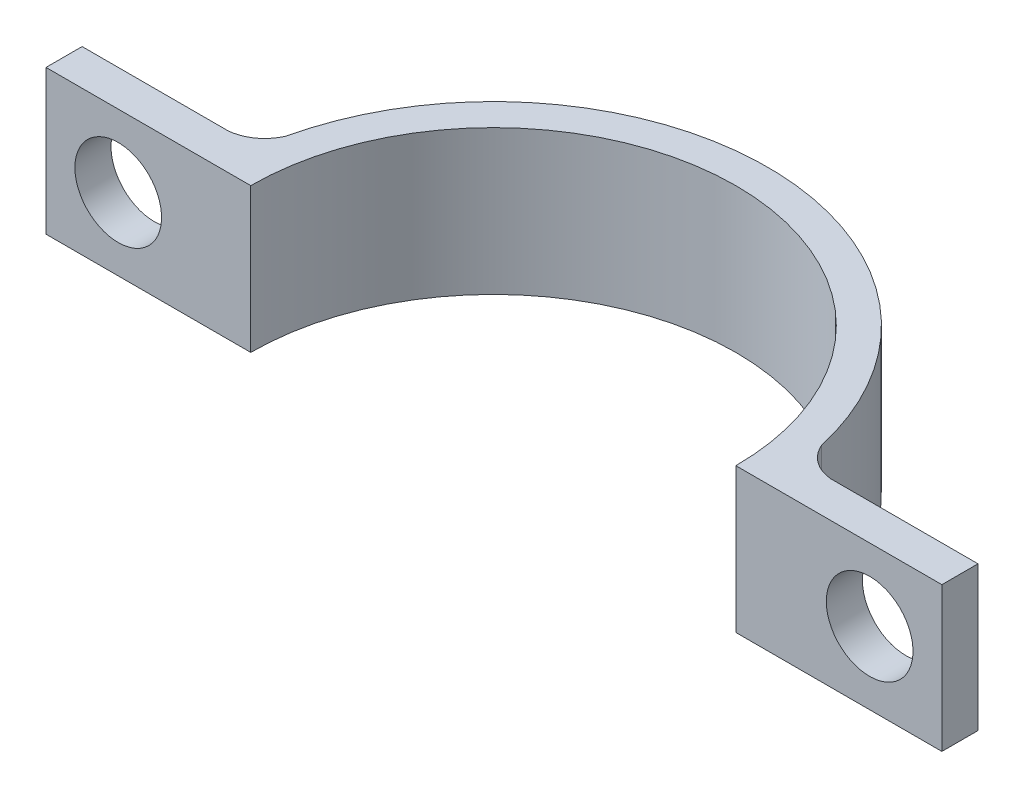
from build123d import *

# Parameters (mm, degrees)
BOSS_EXTRUDE1_DEPTH = 10
SKETCH2_R           = 3
CUT_EXTRUDE1_DEPTH  = 8


with BuildPart() as part:
    # Sketch1 → Boss-Extrude1 (new body)
    with BuildSketch(Plane(origin=(0, 0, 0), x_dir=(1, 0, 0), z_dir=(0, 1, 0))):
        with BuildLine():
            Line((-14.99271565, -10.052675371), (-29.165444207, -10.052675371))
            Line((-29.165444207, -10.052675371), (-29.165444207, -7.552675371))
            Line((-29.165444207, -7.552675371), (-19.04460375, -7.552675371))
            ThreePointArc((-19.04460375, -7.552675371), (-17.652378747, -7.021091902), (-16.731881464, -5.849103764))
            ThreePointArc((-16.731881464, -5.849103764), (1.79728435, 8.947324629), (20.326450163, -5.849103764))
            ThreePointArc((20.326450163, -5.849103764), (21.246947447, -7.021091902), (22.63917245, -7.552675371))
            Line((22.63917245, -7.552675371), (32.849946683, -7.552675371))
            Line((32.849946683, -7.552675371), (32.849946683, -10.052675371))
            Line((32.849946683, -10.052675371), (18.58728435, -10.052675371))
            ThreePointArc((18.58728435, -10.052675371), (1.79728435, 6.737324629), (-14.99271565, -10.052675371))
        make_face()
    extrude(amount=BOSS_EXTRUDE1_DEPTH)

    # Sketch2 → Cut-Extrude1 (cut)
    with BuildSketch(Plane(origin=(0, 0, 7.552675371), x_dir=(-1, 0, 0), z_dir=(0, 0, -1))):
        with Locations((24.165444207, 5)):
            Circle(SKETCH2_R)
        with Locations((-27.849946683, 5)):
            Circle(SKETCH2_R)
    extrude(amount=-CUT_EXTRUDE1_DEPTH, mode=Mode.SUBTRACT)


solid = part.part
